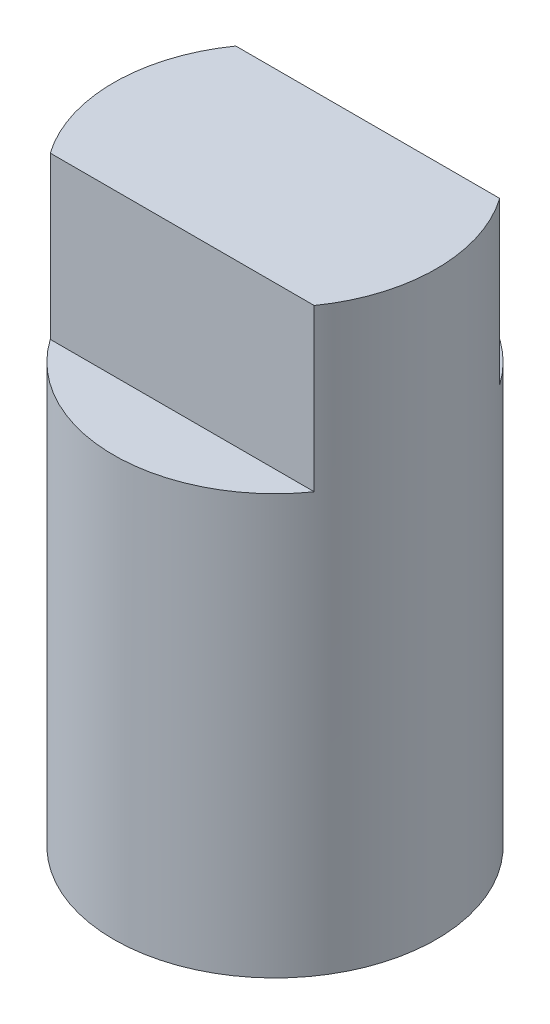
from build123d import *

# Parameters (mm, degrees)
SKETCH1_R           = 25.4
BOSS_EXTRUDE1_DEPTH = 91.44
CUT_EXTRUDE1_REACH  = 109.643
SKETCH2_W           = 10.795
SKETCH2_H           = 25.4


with BuildPart() as part:
    # Sketch1 → Boss-Extrude1 (new body)
    with BuildSketch(Plane(origin=(0, 0, 0), x_dir=(1, 0, 0), z_dir=(0, 1, 0))):
        with Locations(Location((0, 0, 0), (0, 0, 270))):
            Circle(SKETCH1_R)
    extrude(amount=BOSS_EXTRUDE1_DEPTH)

    # Sketch2 → Cut-Extrude1 (cut, up to next)
    with BuildSketch(Plane(origin=(25.4, 0, 0), x_dir=(0, 0, -1), z_dir=(1, 0, 0)), mode=Mode.PRIVATE) as cut_extrude1_sk1:
        with Locations((-20.0025, 78.74)):
            Rectangle(SKETCH2_W, SKETCH2_H)
    cut_extrude1_tool1 = extrude(cut_extrude1_sk1.sketch, amount=-CUT_EXTRUDE1_REACH, mode=Mode.PRIVATE) & part.part
    # Sketch2 → Cut-Extrude1 (cut, up to next)
    with BuildSketch(Plane(origin=(25.4, 0, 0), x_dir=(0, 0, -1), z_dir=(1, 0, 0)), mode=Mode.PRIVATE) as cut_extrude1_sk2:
        with Locations((20.0025, 78.74)):
            Rectangle(SKETCH2_W, SKETCH2_H)
    cut_extrude1_tool2 = extrude(cut_extrude1_sk2.sketch, amount=-CUT_EXTRUDE1_REACH, mode=Mode.PRIVATE) & part.part
    add(cut_extrude1_tool1.solids().sort_by_distance((25.4, 78.74, 20.0025))[0], mode=Mode.SUBTRACT)
    add(cut_extrude1_tool2.solids().sort_by_distance((25.4, 78.74, -20.0025))[0], mode=Mode.SUBTRACT)


solid = part.part
